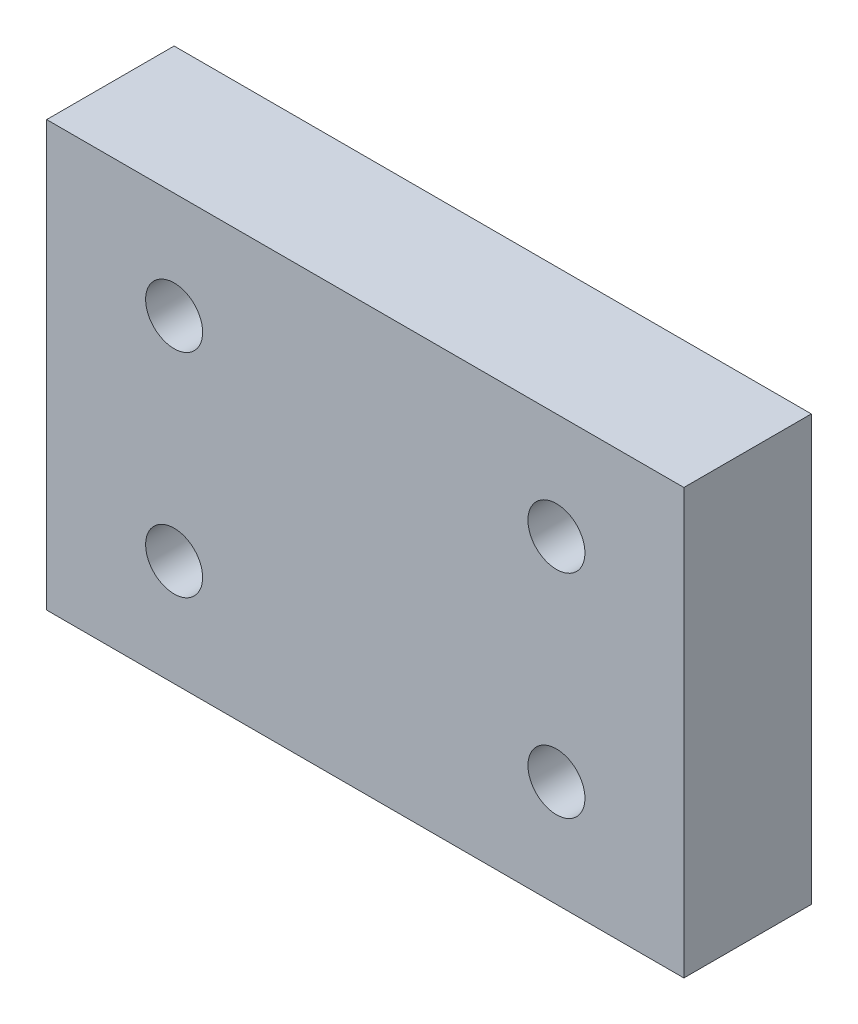
from build123d import *

# Parameters (mm, degrees)
ESQUISSE1_W        = 30
ESQUISSE1_H        = 20
ESQUISSE1_R        = 1.341808551
BOSS_EXTRU_1_DEPTH = 6


with BuildPart() as part:
    # Esquisse1 → Boss.-Extru.1 (new body)
    with BuildSketch(Plane.XY):
        with Locations((15, 10)):
            Rectangle(ESQUISSE1_W, ESQUISSE1_H)
        with Locations((6, 15)):
            Circle(ESQUISSE1_R, mode=Mode.SUBTRACT)
        with Locations(Location((24, 15, 0), (0, 0, 180))):
            Circle(ESQUISSE1_R, mode=Mode.SUBTRACT)
        with Locations((24, 5)):
            Circle(ESQUISSE1_R, mode=Mode.SUBTRACT)
        with Locations(Location((6, 5, 0), (0, 0, 180))):
            Circle(ESQUISSE1_R, mode=Mode.SUBTRACT)
    extrude(amount=BOSS_EXTRU_1_DEPTH)


solid = part.part
